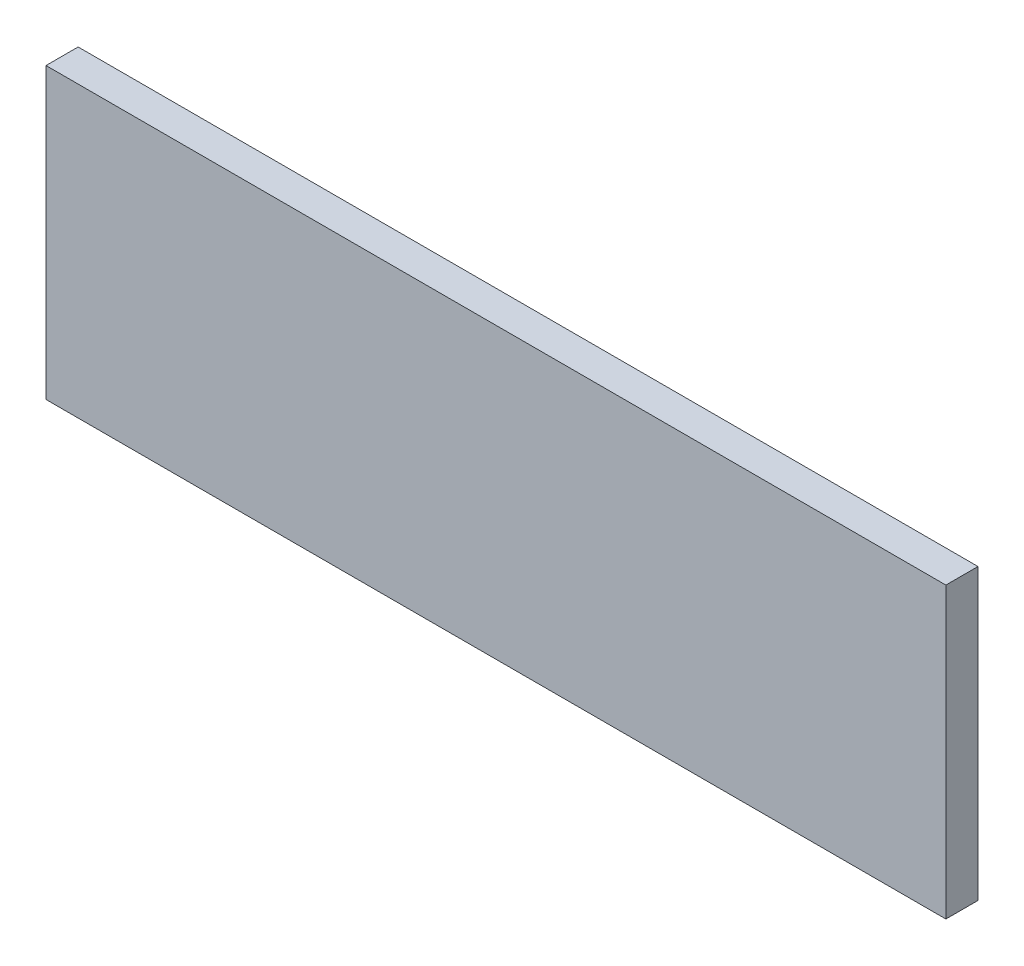
from build123d import *

# Parameters (mm, degrees)
SKETCH1_W           = 355.6
SKETCH1_H           = 114.3
BOSS_EXTRUDE1_DEPTH = 12.7


with BuildPart() as part:
    # Sketch1 → Boss-Extrude1 (new body)
    with BuildSketch(Plane.XY):
        with Locations((177.8, 57.15)):
            Rectangle(SKETCH1_W, SKETCH1_H)
    extrude(amount=BOSS_EXTRUDE1_DEPTH)


solid = part.part
